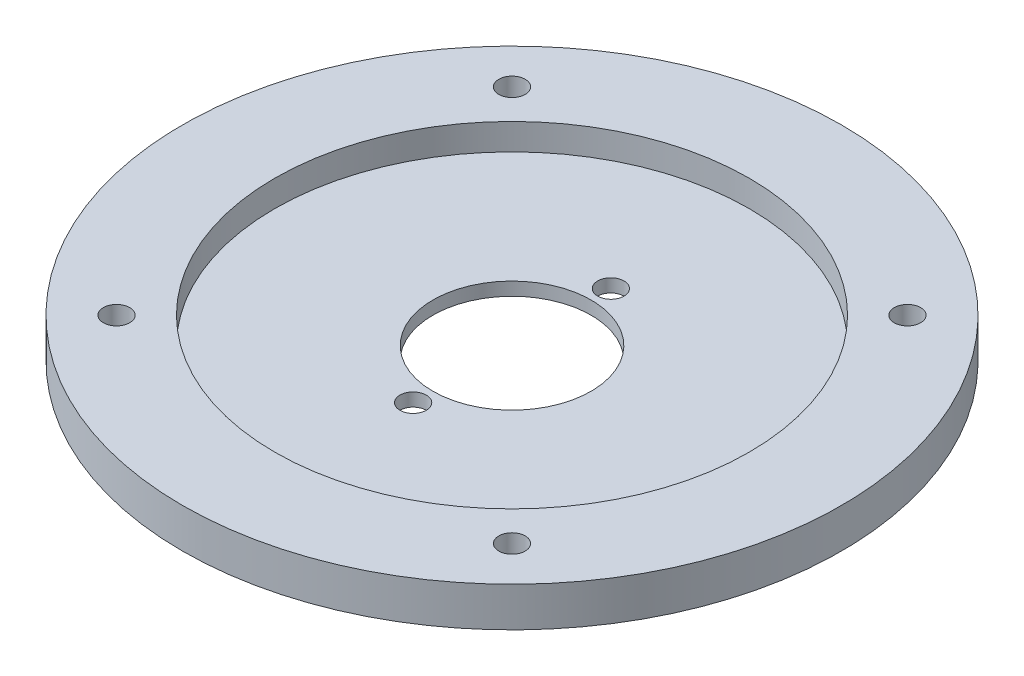
from build123d import *

# Parameters (mm, degrees)
SKETCH1_R           = 25
BOSS_EXTRUDE1_DEPTH = 3
SKETCH3_R           = 6
SKETCH3_R_2         = 1
CUT_EXTRUDE1_DEPTH  = 36.482389998
SKETCH4_R           = 1
CUT_EXTRUDE2_DEPTH  = 36.482389998
CHAMFER1_SIZE       = 1
SKETCH5_R           = 18
CUT_EXTRUDE3_DEPTH  = 2


with BuildPart() as part:
    # Sketch1 → Boss-Extrude1 (new body)
    with BuildSketch(Plane(origin=(0, 0, 0), x_dir=(1, 0, 0), z_dir=(0, 1, 0))):
        with Locations(Location((0, 0, 0), (0, 0, 270))):
            Circle(SKETCH1_R)
    extrude(amount=BOSS_EXTRUDE1_DEPTH)

    # Sketch3 → Cut-Extrude1 (cut, through all)
    with BuildSketch(Plane(origin=(0, 3, 0), x_dir=(1, 0, 0), z_dir=(0, 1, 0))):
        with Locations(Location((0, 0, 0), (0, 0, 270))):
            Circle(SKETCH3_R)
        with Locations(Location((0, 7.5, 0), (0, 0, 270))):
            Circle(SKETCH3_R_2)
        with Locations(Location((0, -7.5, 0), (0, 0, 270))):
            Circle(SKETCH3_R_2)
    extrude(amount=-CUT_EXTRUDE1_DEPTH, mode=Mode.SUBTRACT)

    # Sketch4 → Cut-Extrude2 (cut, through all)
    with BuildSketch(Plane(origin=(0, 3, 0), x_dir=(1, 0, 0), z_dir=(0, 1, 0))):
        with Locations(Location((-15, 15, 0), (0, 0, 270))):
            Circle(SKETCH4_R)
        with Locations(Location((15, 15, 0), (0, 0, 270))):
            Circle(SKETCH4_R)
        with Locations(Location((15, -15, 0), (0, 0, 270))):
            Circle(SKETCH4_R)
        with Locations(Location((-15, -15, 0), (0, 0, 270))):
            Circle(SKETCH4_R)
    extrude(amount=-CUT_EXTRUDE2_DEPTH, mode=Mode.SUBTRACT)

    # Chamfer1
    chamfer1_edges = [part.edges().sort_by_distance(p)[0] for p in [
        (-15, 0, 14),
        (15, 0, 14),
        (15, 0, -16),
        (-15, 0, -16),
    ]]
    chamfer(chamfer1_edges, length=CHAMFER1_SIZE)

    # Sketch5 → Cut-Extrude3 (cut)
    with BuildSketch(Plane(origin=(0, 3, 0), x_dir=(1, 0, 0), z_dir=(0, 1, 0))):
        with Locations(Location((0, 0, 0), (0, 0, 270))):
            Circle(SKETCH5_R)
    extrude(amount=-CUT_EXTRUDE3_DEPTH, mode=Mode.SUBTRACT)


solid = part.part
